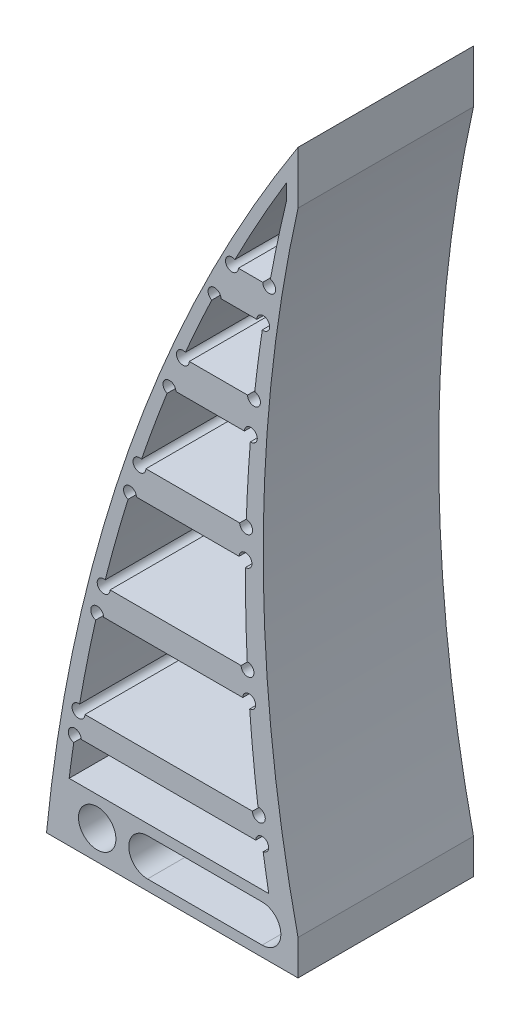
from build123d import *

# Parameters (mm, degrees)
ESQUISSE1_R        = 1.6
BOSS_EXTRU_1_DEPTH = 15


with BuildPart() as part:
    # Esquisse1 → Boss.-Extru.1 (new body)
    with BuildSketch(Plane.XY.offset(15)):
        with BuildLine():
            Line((0, 57), (0, 61.5))
            ThreePointArc((0, 61.5), (-14.418041681, 32.032323515), (-21.5, 0))
            Line((-21.5, 0), (0, 0))
            Line((0, 0), (0, 3))
            ThreePointArc((0, 3), (-2.977286407, 30), (0, 57))
        make_face()
        with Locations(Location((-17.168486885, 2.5, 0), (0, 0, 180))):
            Circle(ESQUISSE1_R, mode=Mode.SUBTRACT)
        with BuildLine():
            Line((-4.312692911, 41), (-9.295115102, 41))
            ThreePointArc((-9.295115102, 41), (-10.303844451, 40.696573922), (-9.629905592, 41.50614708))
            ThreePointArc((-9.629905592, 41.50614708), (-8.526904057, 44.016241784), (-7.373977837, 46.503800615))
            ThreePointArc((-7.373977837, 46.503800615), (-7.430000368, 47.465288022), (-6.586730771, 47))
            Line((-6.586730771, 47), (-3.520929736, 47))
            ThreePointArc((-3.520929736, 47), (-2.553456769, 47.358073068), (-3.054688564, 46.456415178))
            ThreePointArc((-3.054688564, 46.456415178), (-3.40258545, 44.004720773), (-3.702576558, 41.546704695))
            ThreePointArc((-3.702576558, 41.546704695), (-3.3956534, 40.590387992), (-4.312692911, 41))
        make_face(mode=Mode.SUBTRACT)
        with BuildLine():
            Line((-10.442809639, 38.2), (-4.583085107, 38.2))
            ThreePointArc((-4.583085107, 38.2), (-3.628372615, 38.572434959), (-4.078693111, 37.651894253))
            ThreePointArc((-4.078693111, 37.651894253), (-4.283108767, 34.702786262), (-4.418771813, 31.7497168))
            ThreePointArc((-4.418771813, 31.7497168), (-4.053800983, 30.804901148), (-4.986419458, 31.2))
            Line((-4.986419458, 31.2), (-13.004497683, 31.2))
            ThreePointArc((-13.004497683, 31.2), (-14.001308767, 30.879282281), (-13.378533522, 31.721091752))
            ThreePointArc((-13.378533522, 31.721091752), (-12.321188046, 34.717395466), (-11.194758267, 37.688417405))
            ThreePointArc((-11.194758267, 37.688417405), (-11.302186638, 38.654737147), (-10.442809639, 38.2))
        make_face(mode=Mode.SUBTRACT)
        with BuildLine():
            Line((-3.015101171, 50), (-5.099632839, 50))
            ThreePointArc((-5.099632839, 50), (-6.119039194, 49.7133684), (-5.398388017, 50.489260707))
            ThreePointArc((-5.398388017, 50.489260707), (-3.263933011, 54.463678409), (-1, 58.365793421))
            Line((-1, 58.365793421), (-1, 56.97280273))
            ThreePointArc((-1, 56.97280273), (-1.724659998, 53.765748342), (-2.365989319, 50.540996156))
            ThreePointArc((-2.365989319, 50.540996156), (-2.112973011, 49.577500581), (-3.015101171, 50))
        make_face(mode=Mode.SUBTRACT)
        with BuildLine():
            Line((-3.89894146, 10.4), (-18.215006404, 10.4))
            ThreePointArc((-18.215006404, 10.4), (-19.185396456, 10.045356229), (-18.672359875, 10.942140776))
            ThreePointArc((-18.672359875, 10.942140776), (-18.026202705, 14.411865345), (-17.291034109, 17.863826355))
            ThreePointArc((-17.291034109, 17.863826355), (-17.51134183, 18.830058701), (-16.618486885, 18.4))
            Line((-16.618486885, 18.4), (-4.723453535, 18.4))
            ThreePointArc((-4.723453535, 18.4), (-3.799031061, 18.802874436), (-4.133243311, 17.851471844))
            ThreePointArc((-4.133243311, 17.851471844), (-3.82459023, 14.393466491), (-3.421455125, 10.945198834))
            ThreePointArc((-3.421455125, 10.945198834), (-2.935188807, 10.037634519), (-3.89894146, 10.4))
        make_face(mode=Mode.SUBTRACT)
        with BuildLine():
            Line((-13.816577523, 28.7), (-5.036607306, 28.7))
            ThreePointArc((-5.036607306, 28.7), (-4.096135841, 29.087339689), (-4.491036271, 28.150017833))
            ThreePointArc((-4.491036271, 28.150017833), (-4.464411374, 24.698655463), (-4.343932147, 21.249293805))
            ThreePointArc((-4.343932147, 21.249293805), (-3.917431797, 20.321070157), (-4.866069695, 20.7))
            Line((-4.866069695, 20.7), (-16.067033334, 20.7))
            ThreePointArc((-16.067033334, 20.7), (-17.050709214, 20.361732013), (-16.483125083, 21.233449698))
            ThreePointArc((-16.483125083, 21.233449698), (-15.552375348, 24.717038741), (-14.53042622, 28.174972758))
            ThreePointArc((-14.53042622, 28.174972758), (-14.692448063, 29.143067028), (-13.816577523, 28.7))
        make_face(mode=Mode.SUBTRACT)
        with BuildLine():
            Line((-18.53749956, 8.4), (-3.612290325, 8.4))
            ThreePointArc((-3.612290325, 8.4), (-2.704133874, 8.817401433), (-2.978748665, 7.85638176))
            ThreePointArc((-2.978748665, 7.85638176), (-2.747523602, 6.426825008), (-2.5, 5))
            Line((-2.5, 5), (-19.566563167, 5))
            ThreePointArc((-19.566563167, 5), (-19.375761002, 6.429149671), (-19.169954701, 7.856215898))
            ThreePointArc((-19.169954701, 7.856215898), (-19.446072894, 8.81704336), (-18.53749956, 8.4))
        make_face(mode=Mode.SUBTRACT)
        with BuildLine():
            Line((-3.068400716, 0.9), (-12.868400716, 0.9))
            ThreePointArc((-12.868400716, 0.9), (-14.468400716, 2.5), (-12.868400716, 4.1))
            Line((-12.868400716, 4.1), (-3.068400716, 4.1))
            ThreePointArc((-3.068400716, 4.1), (-1.468400716, 2.5), (-3.068400716, 0.9))
        make_face(mode=Mode.SUBTRACT)
    extrude(amount=-BOSS_EXTRU_1_DEPTH)


solid = part.part
